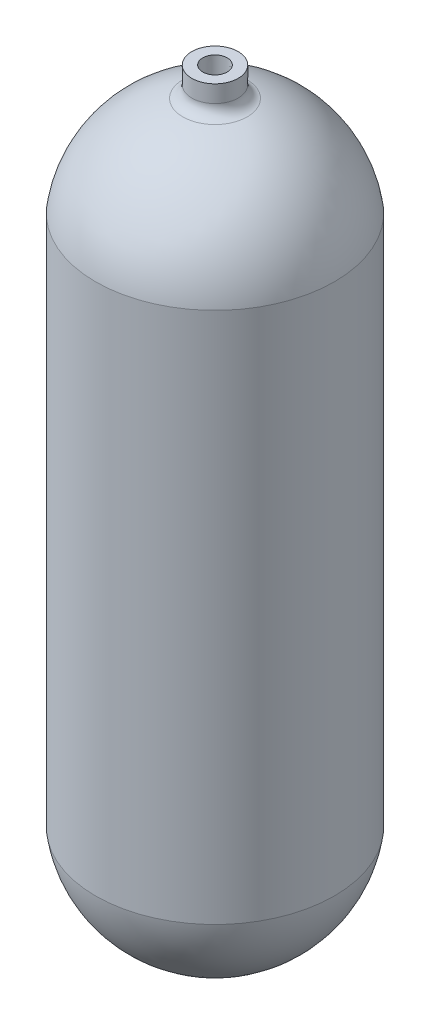
from build123d import *

# Parameters (mm, degrees)
Y_KSEKLIK_EKSTR_ZYON1_DEPTH      = 195
Y_KSEKLIK_EKSTR_ZYON1_DEPTH_BACK = 195
IZIM2_R                          = 87.5
IZIM2_R_2                        = 79.5
RADYUS1_R                        = 9


with BuildPart() as part:
    # Çizim2 → Yükseklik-Ekstrüzyon1 (new, two sides: drawn at the far end of the back side and taken through both)
    with BuildSketch(Plane(origin=(0, 0, 0), x_dir=(1, 0, 0), z_dir=(0, 1, 0)).offset(-Y_KSEKLIK_EKSTR_ZYON1_DEPTH_BACK)):
        Circle(IZIM2_R)
        Circle(IZIM2_R_2, mode=Mode.SUBTRACT)
    extrude(amount=Y_KSEKLIK_EKSTR_ZYON1_DEPTH + Y_KSEKLIK_EKSTR_ZYON1_DEPTH_BACK)

    # Çizim3 → Döndür1 (revolve)
    with BuildSketch(Plane(origin=(0, 0, 0), x_dir=(0, 0, -1), z_dir=(1, 0, 0))):
        with BuildLine():
            Line((-9.025918617, 281.086559343), (-9, 289))
            Line((-9, 289), (-17, 289))
            Line((-17, 289), (-17, 269.349416033))
            ThreePointArc((-17, 269.349416033), (-64.125045155, 243.434926699), (-87.5, 195))
            Line((-87.5, 195), (-79.5, 195))
            ThreePointArc((-79.5, 195), (-55.708005592, 240.680658931), (-9.086559343, 262.571806636))
            Line((-9.086559343, 262.571806636), (-9.025918617, 281.086559343))
        make_face()
    revolve(axis=Axis((0, 271, 0), (0, -1, 0)))

    # Çizim4 → Döndür2 (revolve)
    with BuildSketch(Plane(origin=(0, 0, 0), x_dir=(0, 0, -1), z_dir=(1, 0, 0))):
        with BuildLine():
            Line((87.5, -195), (79.5, -195))
            ThreePointArc((79.5, -195), (52.335527042, -243.73853538), (0, -263.086559343))
            Line((0, -263.086559343), (0, -271))
            ThreePointArc((0, -271), (57.94879205, -249.347293478), (87.5, -195))
        make_face()
    revolve(axis=Axis((0, 271, 0), (0, -1, 0)))

    # Radyus1
    radyus1_edges = [part.edges().sort_by_distance(p)[0] for p in [
        (0, 269.349416033, -17),
    ]]
    fillet(radyus1_edges, radius=RADYUS1_R)


solid = part.part
